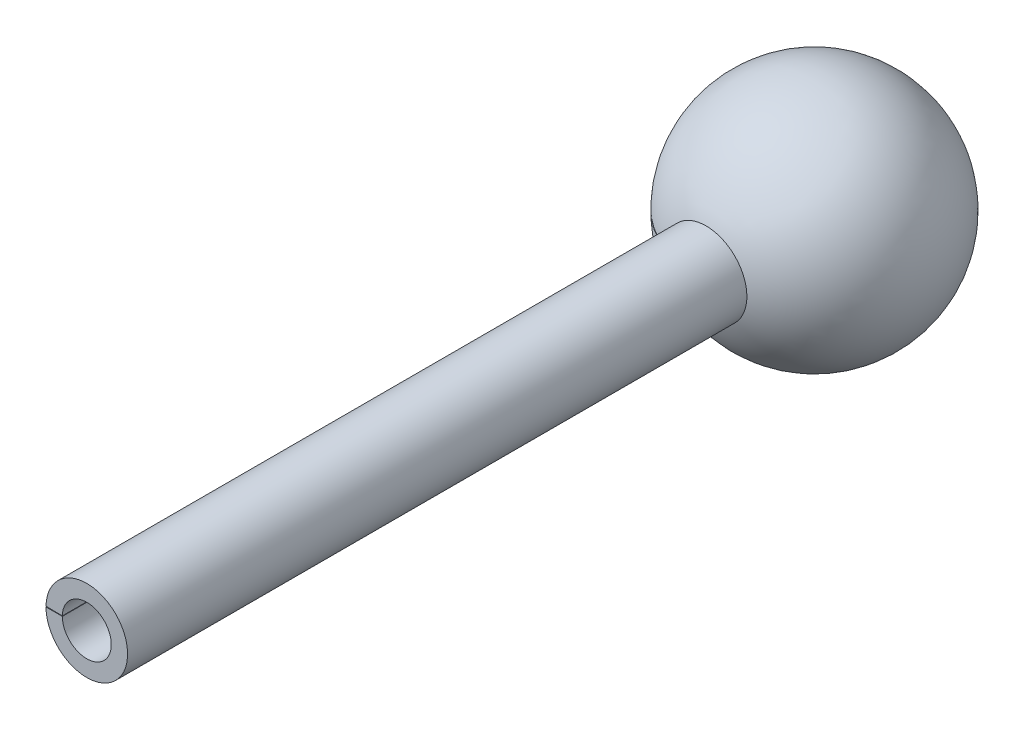
from build123d import *

# Parameters (mm, degrees)
REVOLVE4_ANGLE     = 359
SKETCH9_R          = 6
CUT_EXTRUDE2_DEPTH = 113


with BuildPart() as part:
    # Sketch2 → Revolve4 (revolve)
    with BuildSketch(Plane(origin=(0, 0, 0), x_dir=(1, 0, 0), z_dir=(0, 1, 0))):
        with BuildLine():
            Line((0, 28.377137052), (0, -28.377137052))
            ThreePointArc((0, -28.377137052), (-28.377137052, 0), (0, 28.377137052))
        make_face()
        with BuildLine():
            Line((0, -178.377137052), (0, -28.377137052))
            ThreePointArc((0, -28.377137052), (-5.082168455, -27.91833575), (-10, -26.556767636))
            Line((-10, -26.556767636), (-10, -178.377137052))
            Line((-10, -178.377137052), (0, -178.377137052))
        make_face()
    revolve(axis=Axis((0, 0, 28.377137052), (0, 0, 1)), revolution_arc=REVOLVE4_ANGLE)

    # Sketch9 → Cut-Extrude2 (cut)
    with BuildSketch(Plane.XY.offset(178.377137052)):
        Circle(SKETCH9_R)
    extrude(amount=-CUT_EXTRUDE2_DEPTH, mode=Mode.SUBTRACT)


solid = part.part
